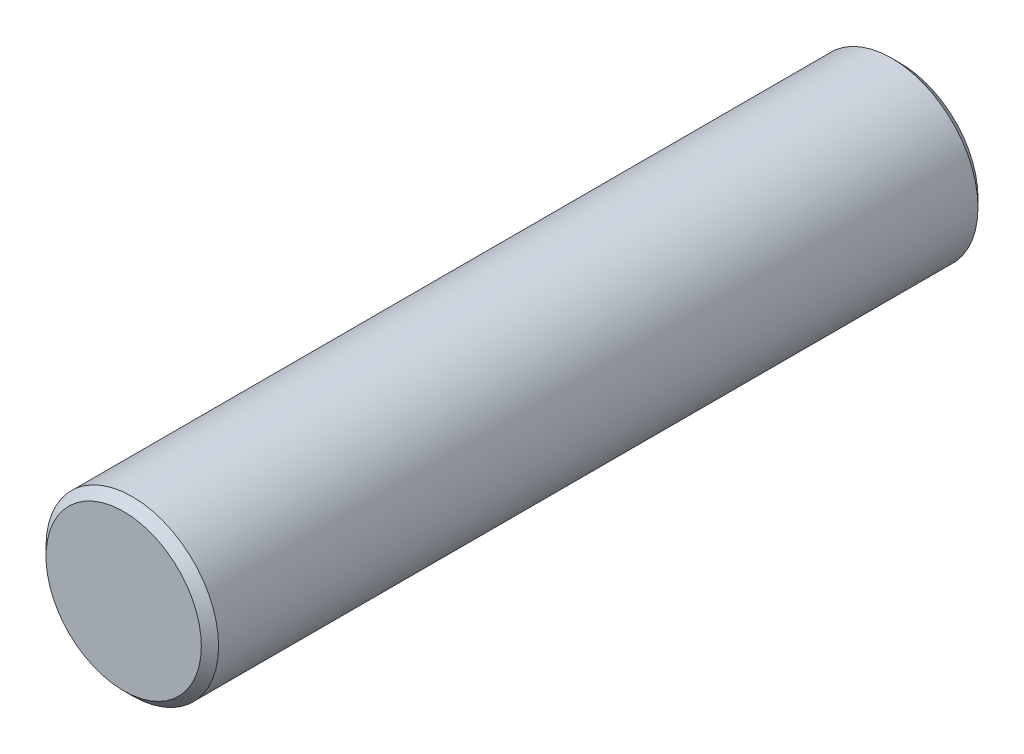
from build123d import *

# Parameters (mm, degrees)
SKETCH1_R           = 2
BOSS_EXTRUDE1_DEPTH = 9
CHAMFER1_SIZE       = 0.2


with BuildPart() as part:
    # Sketch1 → Boss-Extrude1 (new, symmetric)
    with BuildSketch(Plane(origin=(0, 0, 0), x_dir=(0, 1, 0), z_dir=(0, 0, 1))):
        with Locations(Location((0, 0, 0), (0, 0, 270))):
            Circle(SKETCH1_R)
    extrude(amount=BOSS_EXTRUDE1_DEPTH, both=True)

    # Chamfer1
    chamfer1_edges = [part.edges().sort_by_distance(p)[0] for p in [
        (-2, 0, -9),
        (-2, 0, 9),
    ]]
    chamfer(chamfer1_edges, length=CHAMFER1_SIZE)


solid = part.part
